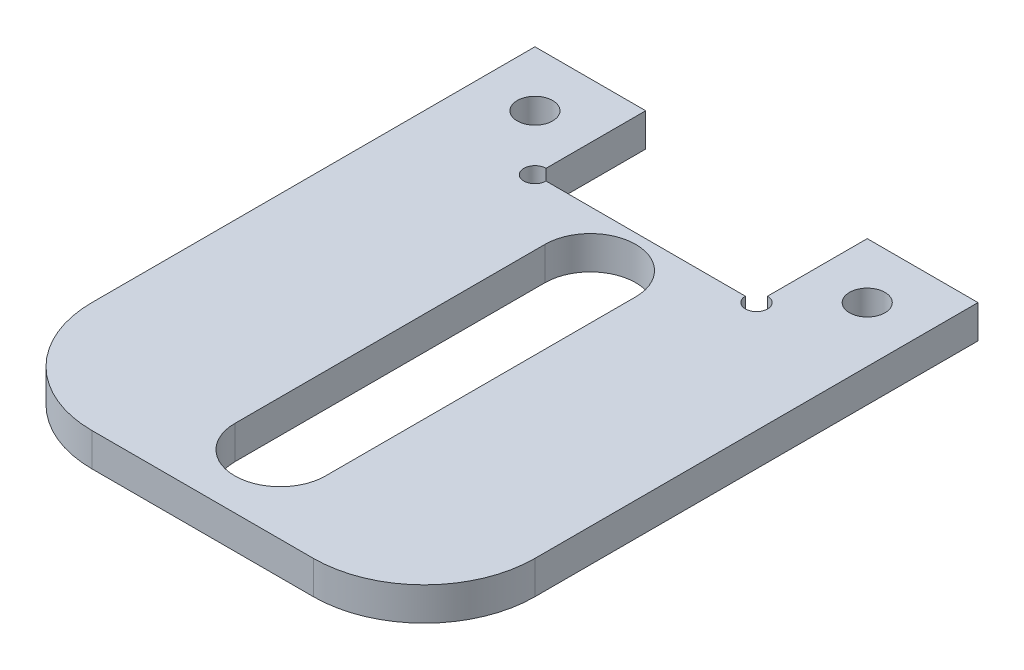
from build123d import *

# Parameters (mm, degrees)
SKETCH_1_R          = 1.6
EXTRUDE_1_DEPTH     = 3
FILLET_1_R          = 10
SKETCH_2_R          = 1
CUT_EXTRUDE_1_DEPTH = 3


with BuildPart() as part:
    # 草图1 → 凸台-拉伸1 (new body)
    with BuildSketch(Plane(origin=(0, 0, 0), x_dir=(1, 0, 0), z_dir=(0, 1, 0))):
        Polygon((-10, 25), (-10, 15), (10, 15), (10, 25), (20, 25), (20, -25), (-20, -25), (-20, 25), align=None)
        with Locations(Location((-15, 20, 0), (0, 0, 270))):
            Circle(SKETCH_1_R, mode=Mode.SUBTRACT)
        with Locations(Location((15, 20, 0), (0, 0, 270))):
            Circle(SKETCH_1_R, mode=Mode.SUBTRACT)
        with BuildLine():
            Line((4.1, 10), (4.1, -18))
            ThreePointArc((4.1, -18), (0, -22.1), (-4.1, -18))
            Line((-4.1, -18), (-4.1, 10))
            ThreePointArc((-4.1, 10), (0, 14.1), (4.1, 10))
        make_face(mode=Mode.SUBTRACT)
    extrude(amount=EXTRUDE_1_DEPTH)

    # 圆角1
    fillet_1_edges = [part.edges().sort_by_distance(p)[0] for p in [
        (20, 1.5, 25),
        (-20, 1.5, 25),
    ]]
    fillet(fillet_1_edges, radius=FILLET_1_R)

    # 草图2 → 切除-拉伸1 (cut)
    with BuildSketch(Plane(origin=(0, 3, 0), x_dir=(1, 0, 0), z_dir=(0, 1, 0))):
        with Locations((-10, 15)):
            Circle(SKETCH_2_R)
        with Locations((10, 15)):
            Circle(SKETCH_2_R)
    extrude(amount=-CUT_EXTRUDE_1_DEPTH, mode=Mode.SUBTRACT)


solid = part.part
